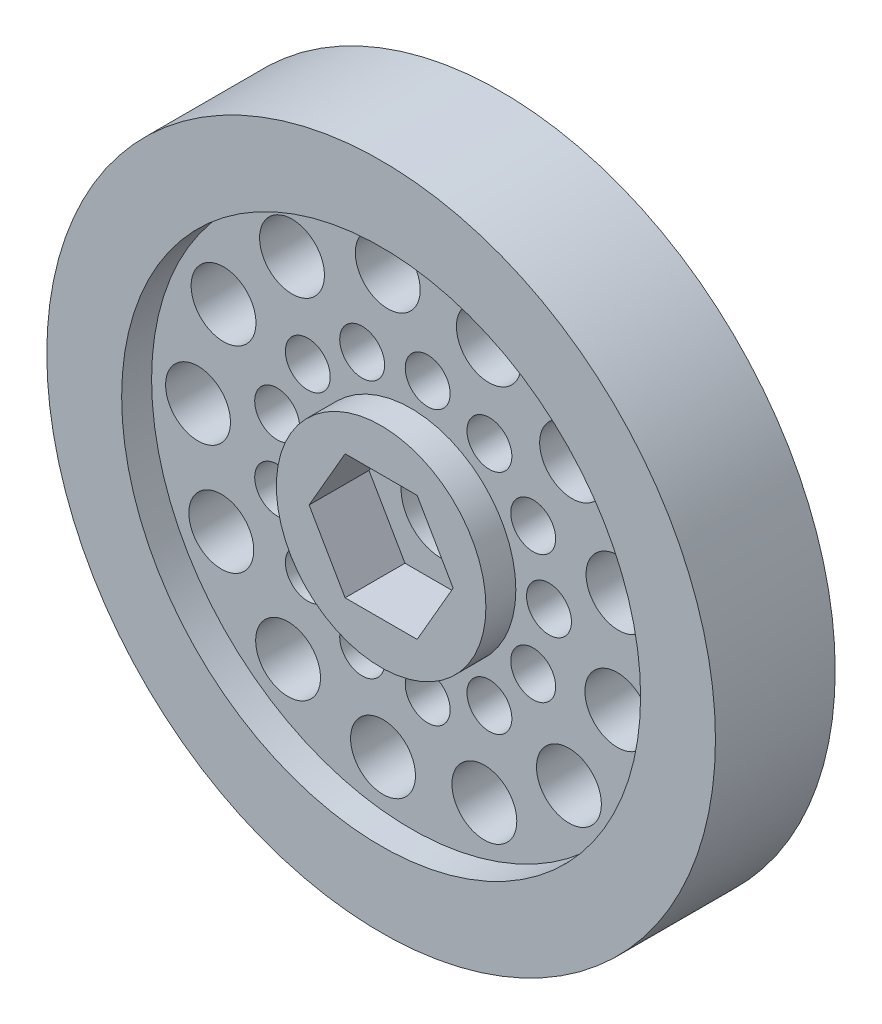
from build123d import *

# Parameters (mm, degrees)
SKETCH1_R           = 33.5
SKETCH1_R_2         = 4
BOSS_EXTRUDE1_DEPTH = 12
CUT_EXTRUDE1_DEPTH  = 6
SKETCH3_R           = 26
SKETCH3_R_2         = 10.5
CUT_EXTRUDE2_DEPTH  = 3
CUT_EXTRUDE3_START  = -3
SKETCH4_R           = 26
SKETCH4_R_2         = 10.5
CUT_EXTRUDE3_DEPTH  = 3
SKETCH5_R           = 2.25
SKETCH5_R_2         = 3.25
CUT_EXTRUDE4_DEPTH  = 10
CIRPATTERN1_COUNT   = 13


with BuildPart() as part:
    # Sketch1 → Boss-Extrude1 (new body)
    with BuildSketch(Plane.XY):
        Circle(SKETCH1_R)
        Circle(SKETCH1_R_2, mode=Mode.SUBTRACT)
    extrude(amount=BOSS_EXTRUDE1_DEPTH)

    # Sketch2 → Cut-Extrude1 (cut)
    with BuildSketch(Plane.XY.offset(12)):
        Polygon((7.216878365, 0), (3.608439182, 6.25), (-3.608439182, 6.25), (-7.216878365, 0), (-3.608439182, -6.25), (3.608439182, -6.25), align=None)
    extrude(amount=-CUT_EXTRUDE1_DEPTH, mode=Mode.SUBTRACT)

    # Sketch3 → Cut-Extrude2 (cut)
    with BuildSketch(Plane.XY.offset(12)):
        Circle(SKETCH3_R)
        Circle(SKETCH3_R_2, mode=Mode.SUBTRACT)
    extrude(amount=-CUT_EXTRUDE2_DEPTH, mode=Mode.SUBTRACT)

    # Sketch4 → Cut-Extrude3 (cut)
    with BuildSketch(Plane(origin=(0, 0, 0), x_dir=(-1, 0, 0), z_dir=(0, 0, -1)).offset(CUT_EXTRUDE3_START)):
        with Locations(Location((0, 0, 0), (0, 0, 180))):
            Circle(SKETCH4_R)
        with Locations(Location((0, 0, 0), (0, 0, 180))):
            Circle(SKETCH4_R_2, mode=Mode.SUBTRACT)
    extrude(amount=CUT_EXTRUDE3_DEPTH, mode=Mode.SUBTRACT)

    # Sketch5 → Cut-Extrude4 (cut)
    with BuildSketch(Plane.XY.offset(9)):
        with Locations((13.82072024, 0)):
            Circle(SKETCH5_R)
        with Locations((20.783512616, 4.875399709)):
            Circle(SKETCH5_R_2)
    cut_extrude4 = extrude(amount=-CUT_EXTRUDE4_DEPTH, mode=Mode.SUBTRACT)

    # CirPattern1: Cut-Extrude4 ×13 about axis
    cirpattern1_axis = Axis((0, 0, 0), (0, 0, 1))
    for i in range(1, CIRPATTERN1_COUNT):
        add(cut_extrude4.rotate(cirpattern1_axis, i * 360 / CIRPATTERN1_COUNT), mode=Mode.SUBTRACT)


solid = part.part
